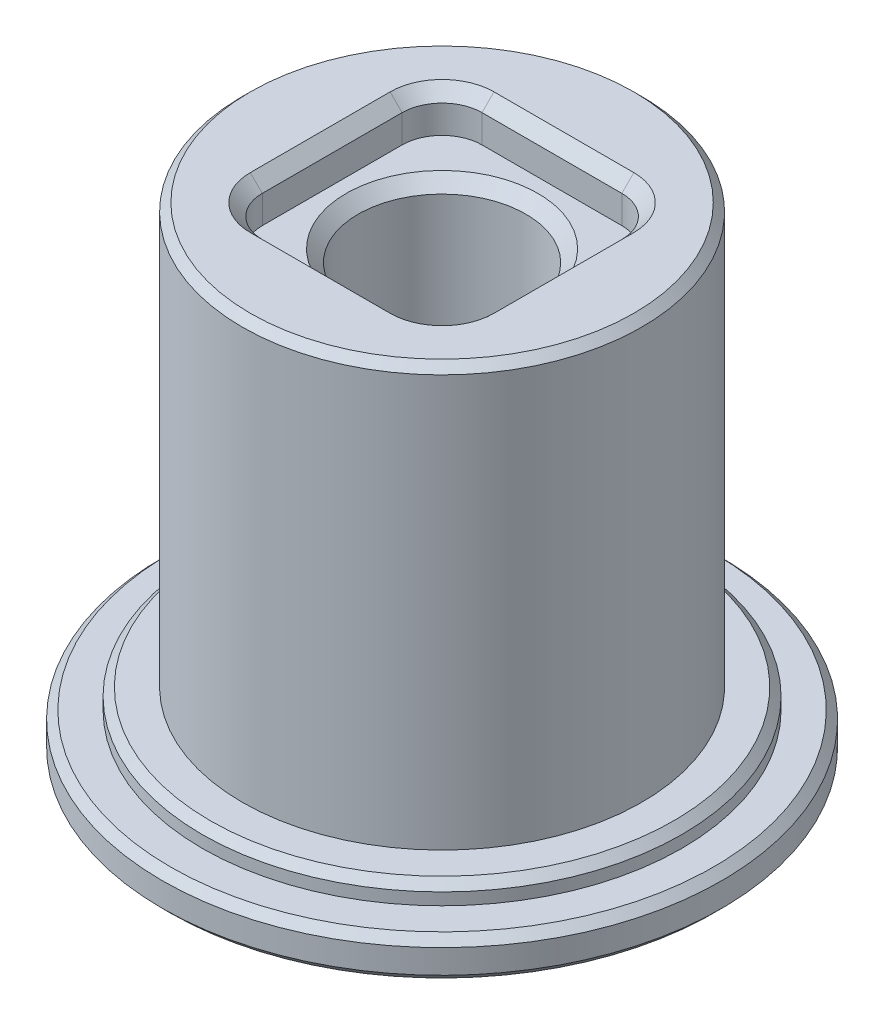
from build123d import *

# Parameters (mm, degrees)
SKETCH_1_R      = 7
SKETCH_1_R_2    = 6
EXTRUDE_1_DEPTH = 1
SKETCH_1_4_R    = 6
SKETCH_1_4_R_2  = 5
EXTRUDE_2_DEPTH = 1.5
SKETCH_1_5_R    = 5
SKETCH_1_5_R_2  = 4.25
EXTRUDE_3_DEPTH = 12
EXTRUDE_START   = 5
SKETCH_1_6_R    = 4.25
SKETCH_1_6_W    = 5.5
SKETCH_1_6_H    = 5.5
EXTRUDE_4_DEPTH = 7
SKETCH_1_7_W    = 5.5
SKETCH_1_7_H    = 5.5
SKETCH_1_7_R    = 2.1
EXTRUDE_5_DEPTH = 6
FILLET_1_R      = 1
CHAMFER_1_SIZE  = 0.2
CHAMFER_2_SIZE  = 0.3
CHAMFER_3_SIZE  = 0.3


with BuildPart() as part:
    # 스케치1 → 보스-돌출1 (new body)
    with BuildSketch(Plane(origin=(0, 0, 0), x_dir=(1, 0, 0), z_dir=(0, 1, 0))):
        Circle(SKETCH_1_R)
        Circle(SKETCH_1_R_2, mode=Mode.SUBTRACT)
    extrude(amount=EXTRUDE_1_DEPTH)

    # 스케치1<4> → 보스-돌출2 (add)
    with BuildSketch(Plane(origin=(0, 0, 0), x_dir=(1, 0, 0), z_dir=(0, 1, 0))):
        Circle(SKETCH_1_4_R)
        Circle(SKETCH_1_4_R_2, mode=Mode.SUBTRACT)
    extrude(amount=EXTRUDE_2_DEPTH)

    # 스케치1<5> → 보스-돌출3 (add)
    with BuildSketch(Plane(origin=(0, 0, 0), x_dir=(1, 0, 0), z_dir=(0, 1, 0))):
        Circle(SKETCH_1_5_R)
        Circle(SKETCH_1_5_R_2, mode=Mode.SUBTRACT)
    extrude(amount=EXTRUDE_3_DEPTH)

    # 스케치1<6> → 보스-돌출4 (add)
    with BuildSketch(Plane(origin=(0, 0, 0), x_dir=(1, 0, 0), z_dir=(0, 1, 0)).offset(EXTRUDE_START)):
        Circle(SKETCH_1_6_R)
        Rectangle(SKETCH_1_6_W, SKETCH_1_6_H, mode=Mode.SUBTRACT)
    extrude(amount=EXTRUDE_4_DEPTH)

    # 스케치1<7> → 보스-돌출5 (add)
    with BuildSketch(Plane(origin=(0, 0, 0), x_dir=(1, 0, 0), z_dir=(0, 1, 0)).offset(EXTRUDE_START)):
        Rectangle(SKETCH_1_7_W, SKETCH_1_7_H)
        Circle(SKETCH_1_7_R, mode=Mode.SUBTRACT)
    extrude(amount=EXTRUDE_5_DEPTH)

    # 필렛1
    fillet_1_edges = [part.edges().sort_by_distance(p)[0] for p in [
        (2.75, 11.5, 2.75),
        (-2.75, 11.5, 2.75),
        (2.75, 11.5, -2.75),
        (-2.75, 11.5, -2.75),
    ]]
    fillet(fillet_1_edges, radius=FILLET_1_R)

    # 모따기1
    chamfer_1_edges = [part.edges().sort_by_distance(p)[0] for p in [
        (-5, 12, 0),
        (-7, 1, 0),
        (-7, 0, 0),
        (-6, 1.5, 0),
    ]]
    chamfer(chamfer_1_edges, length=CHAMFER_1_SIZE)

    # 모따기2
    chamfer_2_edges = [part.edges().sort_by_distance(p)[0] for p in [
        (-4.25, 0, 0),
    ]]
    chamfer(chamfer_2_edges, length=CHAMFER_2_SIZE)

    # 모따기3
    chamfer_3_edges = [part.edges().sort_by_distance(p)[0] for p in [
        (-2.1, 11, 0),
        (0, 12, 2.75),
        (2.75, 12, 0),
        (-2.75, 12, 0),
        (0, 12, -2.75),
        (-2.457106781, 12, 2.457106781),
        (2.457106781, 12, 2.457106781),
        (-2.457106781, 12, -2.457106781),
        (2.457106781, 12, -2.457106781),
    ]]
    chamfer(chamfer_3_edges, length=CHAMFER_3_SIZE)


solid = part.part
